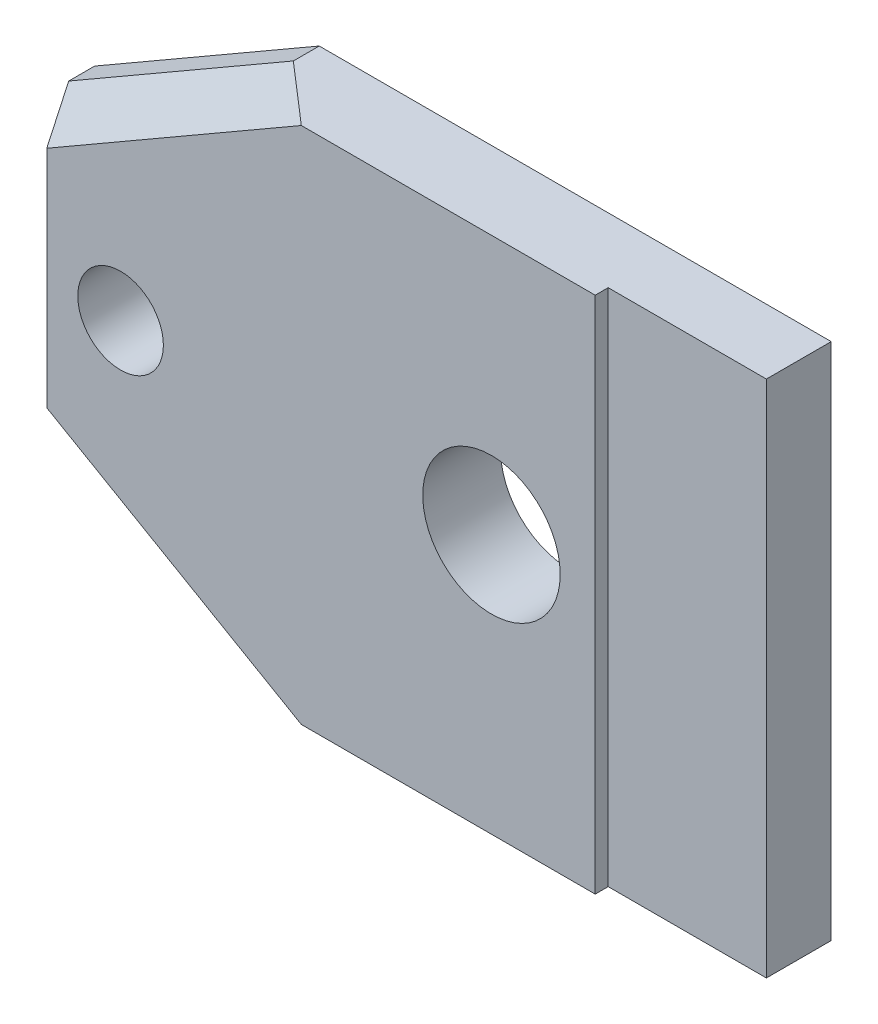
from build123d import *
from OCP.BRepFilletAPI import BRepFilletAPI_MakeChamfer

# Parameters (mm, degrees)
AUFSATZ_LINEAR_AUSTRAGEN1_DEPTH    = 20
SKIZZE2_R                          = 1.65
SKIZZE2_R_2                        = 2.65
SCHNITT_LINEAR_AUSTRAGEN1_DEPTH    = 3
FASE1_SIZE                         = 5
FASE1_SIZE2                        = 8.660254038
FASE2_SIZE                         = 2
FASE2_SIZE2                        = 1.154700538
K_RPER_VERSCHIEBEN_KOPIEREN1_ANGLE = 90


with BuildPart() as part:
    # Skizze1 → Aufsatz-Linear austragen1 (new body)
    with BuildSketch(Plane.XY):
        Polygon((0, 0), (28.4, 0), (28.4, 2.5), (22.3, 2.5), (22.3, 3), (0, 3), align=None)
    extrude(amount=AUFSATZ_LINEAR_AUSTRAGEN1_DEPTH)

    # Skizze2 → Schnitt-Linear austragen1 (cut)
    with BuildSketch(Plane.XZ):
        with Locations(Location((4, 10, 0), (0, 0, 270))):
            Circle(SKIZZE2_R)
        with Locations(Location((18.3, 10, 0), (0, 0, 270))):
            Circle(SKIZZE2_R_2)
    extrude(amount=-SCHNITT_LINEAR_AUSTRAGEN1_DEPTH, mode=Mode.SUBTRACT)

    # Fase1
    fase1_edges = [part.edges().sort_by_distance(p)[0] for p in [
        (0, 1.5, 20),
        (0, 1.5, 0),
    ]]
    fase1_side = [part.faces().sort_by_distance(p)[0] for p in [
        (0, 1.5, 10),
    ]]
    chamfer(fase1_edges, length=FASE1_SIZE, length2=FASE1_SIZE2, reference=fase1_side[0])

    # Fase2: one chamfer whose edges measure the first distance from different faces: ONE call of the kernel's chamfer builder (chamfer() names one face for all edges)
    fase2_edges_1 = [part.edges().sort_by_distance(p)[0] for p in [
        (0, 3, 10),
    ]]
    fase2_side_1 = [part.faces().sort_by_distance(p)[0] for p in [
        (0, 1.5, 10),
    ]]
    fase2_edges_2 = [part.edges().sort_by_distance(p)[0] for p in [
        (4.330127019, 3, 17.5),
    ]]
    fase2_side_2 = [part.faces().sort_by_distance(p)[0] for p in [
        (4.330127019, 1.5, 17.5),
    ]]
    fase2_edges_3 = [part.edges().sort_by_distance(p)[0] for p in [
        (4.330127019, 3, 2.5),
    ]]
    fase2_side_3 = [part.faces().sort_by_distance(p)[0] for p in [
        (4.330127019, 1.5, 2.5),
    ]]
    fase2 = BRepFilletAPI_MakeChamfer(part.part.solid().wrapped)
    for e in fase2_edges_1:
        fase2.Add(FASE2_SIZE, FASE2_SIZE2, e.wrapped, fase2_side_1[0].wrapped)  # the first distance lies on this face
    for e in fase2_edges_2:
        fase2.Add(FASE2_SIZE, FASE2_SIZE2, e.wrapped, fase2_side_2[0].wrapped)  # the first distance lies on this face
    for e in fase2_edges_3:
        fase2.Add(FASE2_SIZE, FASE2_SIZE2, e.wrapped, fase2_side_3[0].wrapped)  # the first distance lies on this face
    add(Compound.cast(fase2.Shape()), mode=Mode.REPLACE)


with BuildPart() as part_1:
    # Körper-Verschieben/Kopieren1: moved
    add(part.part.rotate(Axis((0, 1.5, 10), (1, 0, 0)), K_RPER_VERSCHIEBEN_KOPIEREN1_ANGLE))


solid = part_1.part
